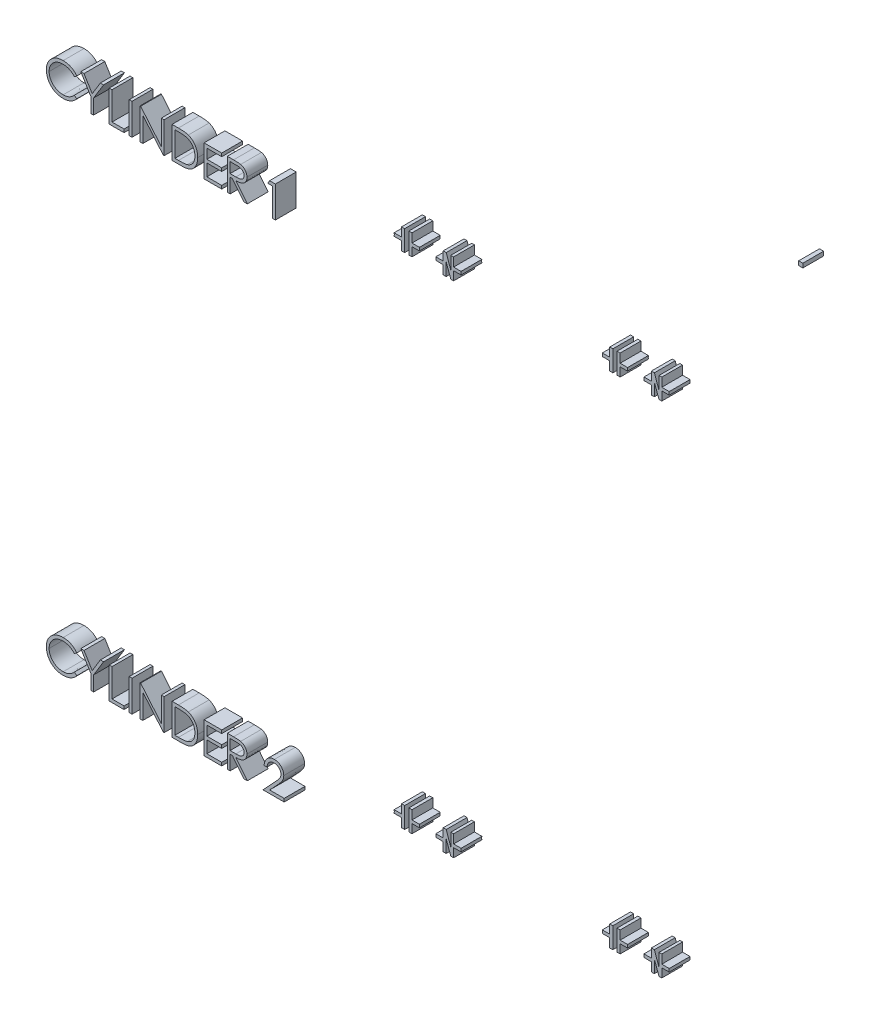
from build123d import *

# Parameters (mm, degrees)
BOSS_EXTRUDE1_DEPTH    = 10
BOSS_EXTRUDE1_2_DEPTH  = 10
BOSS_EXTRUDE1_3_DEPTH  = 10
SKETCH1_W              = 1.346153846
SKETCH1_H              = 15
BOSS_EXTRUDE1_4_DEPTH  = 10
BOSS_EXTRUDE1_5_DEPTH  = 10
BOSS_EXTRUDE1_6_DEPTH  = 10
BOSS_EXTRUDE1_7_DEPTH  = 10
BOSS_EXTRUDE1_8_DEPTH  = 10
BOSS_EXTRUDE1_9_DEPTH  = 10
BOSS_EXTRUDE1_10_DEPTH = 10
BOSS_EXTRUDE1_11_DEPTH = 10
BOSS_EXTRUDE1_12_DEPTH = 10
BOSS_EXTRUDE1_13_DEPTH = 10
BOSS_EXTRUDE1_14_DEPTH = 10
BOSS_EXTRUDE1_15_DEPTH = 10
SKETCH1_W_2            = 2
SKETCH1_H_2            = 2
BOSS_EXTRUDE1_16_DEPTH = 10
BOSS_EXTRUDE1_17_DEPTH = 10
BOSS_EXTRUDE1_18_DEPTH = 10
BOSS_EXTRUDE1_19_DEPTH = 10
BOSS_EXTRUDE1_20_DEPTH = 10
BOSS_EXTRUDE1_21_DEPTH = 10
BOSS_EXTRUDE1_22_DEPTH = 10
BOSS_EXTRUDE1_23_DEPTH = 10
BOSS_EXTRUDE1_24_DEPTH = 10
BOSS_EXTRUDE1_25_DEPTH = 10
BOSS_EXTRUDE1_26_DEPTH = 10
BOSS_EXTRUDE1_27_DEPTH = 10
BOSS_EXTRUDE1_28_DEPTH = 10
BOSS_EXTRUDE1_29_DEPTH = 10
BOSS_EXTRUDE1_30_DEPTH = 10
BOSS_EXTRUDE1_31_DEPTH = 10


with BuildPart() as part:
    # Sketch1 → Boss-Extrude1 (new body)
    with BuildSketch(Plane.XY):
        with BuildLine():
            Line((575.642307692, 223.626418269), (574.464423077, 224.518846154))
            add(Edge.make_bspline(
                [(574.464423077, 224.518846154), (574.282999257, 224.319685088), (573.927408048, 223.929328824), (573.33605846, 223.418093112), (572.712072773, 222.98653078), (572.054924289, 222.630536689), (571.363584632, 222.356688451), (570.64000278, 222.16101166), (569.88413981, 222.040329164), (569.368719629, 222.026083781), (569.106850962, 222.018846154)],
                knots=[0, 0, 0, 0, 0.132188852, 0.259090531, 0.382819359, 0.504060246, 0.625245266, 0.747051364, 0.87148481, 1, 1, 1, 1], degree=3))
            add(Edge.make_bspline(
                [(569.106850962, 222.018846154), (568.869173258, 222.023281916), (568.402161544, 222.031997722), (567.718710136, 222.123035638), (567.06550384, 222.262596168), (566.443963352, 222.460839286), (565.855206365, 222.7187362), (565.294702275, 223.028657125), (564.768639797, 223.400445331), (564.278329157, 223.822647011), (563.831438788, 224.284831073), (563.443082199, 224.783759206), (563.107765292, 225.307640007), (562.842397933, 225.864390113), (562.627188317, 226.444589437), (562.483595069, 227.055392324), (562.389102209, 227.692980655), (562.378484719, 228.128270305), (562.373076923, 228.349975962)],
                knots=[0, 0, 0, 0, 0.068959261, 0.135497702, 0.199770956, 0.262666103, 0.324516234, 0.386081404, 0.448275028, 0.511160094, 0.573673691, 0.634570614, 0.694424357, 0.753853568, 0.813273531, 0.873709896, 0.935676783, 1, 1, 1, 1], degree=3))
            add(Edge.make_bspline(
                [(562.373076923, 228.349975962), (562.37480555, 228.497328914), (562.378234879, 228.789654539), (562.42318547, 229.220941738), (562.488018313, 229.6417594), (562.581980528, 230.051228397), (562.700691568, 230.450447657), (562.85071352, 230.836608099), (563.020127289, 231.214072687), (563.222467574, 231.576377508), (563.448397682, 231.92486354), (563.693478012, 232.258515713), (563.962566486, 232.572934319), (564.254731979, 232.86711415), (564.56785746, 233.14419032), (564.902263037, 233.402915019), (565.258213241, 233.644257956), (565.63440986, 233.865518433), (566.027059452, 234.061410976), (566.426533452, 234.238646004), (566.838358032, 234.381897778), (567.256570711, 234.501780431), (567.683905566, 234.596603245), (568.119818643, 234.660508431), (568.564026386, 234.70597611), (568.863344926, 234.709422578), (569.013701923, 234.711153846)],
                knots=[0, 0, 0, 0, 0.043076442, 0.085457044, 0.126680955, 0.167541081, 0.208224423, 0.248372742, 0.288616056, 0.329131374, 0.36959477, 0.410019977, 0.450116969, 0.4905082, 0.53118205, 0.572314273, 0.614074837, 0.65687851, 0.699847251, 0.74235017, 0.784596933, 0.827247979, 0.869537373, 0.912498125, 0.956045091, 1, 1, 1, 1], degree=3))
            add(Edge.make_bspline(
                [(569.013701923, 234.711153846), (569.286618569, 234.704254849), (569.82317971, 234.690691242), (570.609655846, 234.565457632), (571.363062299, 234.368729498), (571.961553078, 234.13410312), (572.419060512, 233.909261751), (572.749909277, 233.723828588), (573.066455557, 233.516952433), (573.373994641, 233.296594865), (573.665076589, 233.051272524), (573.944940772, 232.789564261), (574.213480212, 232.510223356), (574.380397841, 232.311293717), (574.464423077, 232.211153846)],
                knots=[0, 0, 0, 0, 0.131817351, 0.259156302, 0.383852034, 0.50754401, 0.569026624, 0.630149934, 0.690705144, 0.751705654, 0.81287878, 0.874525059, 0.936836741, 1, 1, 1, 1], degree=3))
            Line((574.464423077, 232.211153846), (575.642307692, 233.112596154))
            add(Edge.make_bspline(
                [(575.642307692, 233.112596154), (575.550441916, 233.233796056), (575.367213937, 233.475531487), (575.070380745, 233.818962162), (574.749117265, 234.136951859), (574.414333504, 234.438659971), (574.056524153, 234.715787865), (573.681674759, 234.97419846), (573.287147679, 235.21169399), (572.87607675, 235.427980024), (572.448590001, 235.620659164), (572.006738486, 235.787958584), (571.553308882, 235.934274148), (571.085640527, 236.04659124), (570.607307747, 236.137088682), (570.115983488, 236.203575566), (569.611329264, 236.243459032), (569.270184275, 236.247549078), (569.097836538, 236.249615385)],
                knots=[0, 0, 0, 0, 0.060488392, 0.120645209, 0.180371681, 0.240193757, 0.299808496, 0.360260137, 0.421209965, 0.48287315, 0.544930238, 0.607604572, 0.670733165, 0.734317765, 0.79878501, 0.864317054, 0.931452463, 1, 1, 1, 1], degree=3))
            add(Edge.make_bspline(
                [(569.097836538, 236.249615385), (568.815049223, 236.242701079), (568.25849597, 236.229093045), (567.442757764, 236.121448261), (566.662400468, 235.948506032), (565.918890404, 235.701458333), (565.213813897, 235.380046208), (564.541891267, 234.995542568), (563.910524921, 234.533515981), (563.320950627, 234.008347327), (562.783318194, 233.433998393), (562.313316156, 232.818926394), (561.914630668, 232.172464088), (561.591893449, 231.490477172), (561.337335355, 230.77817541), (561.158111942, 230.031812272), (561.04670139, 229.252781044), (561.033588192, 228.72194851), (561.026923077, 228.452139423)],
                knots=[0, 0, 0, 0, 0.067671688, 0.133184538, 0.196584735, 0.258754454, 0.320344524, 0.381783214, 0.443742231, 0.507256563, 0.570530156, 0.631765485, 0.692252318, 0.751986087, 0.81204519, 0.872986468, 0.935442154, 1, 1, 1, 1], degree=3))
            add(Edge.make_bspline(
                [(561.026923077, 228.452139423), (561.032391626, 228.195437377), (561.043150007, 227.690422568), (561.137228311, 226.947931387), (561.282004862, 226.233436326), (561.490988004, 225.547604666), (561.758313379, 224.890090686), (562.088945758, 224.26236979), (562.475198688, 223.661144156), (562.777099303, 223.290186826), (562.928966346, 223.103581731)],
                knots=[0, 0, 0, 0, 0.132689425, 0.261042424, 0.386386228, 0.509266138, 0.631220251, 0.752843984, 0.87567149, 1, 1, 1, 1], degree=3))
            add(Edge.make_bspline(
                [(562.928966346, 223.103581731), (563.023782267, 222.996155699), (563.212365203, 222.782492042), (563.517175815, 222.486186281), (563.832833781, 222.209043562), (564.16110914, 221.951997982), (564.504846658, 221.718619366), (564.858968511, 221.501411375), (565.226956274, 221.305161837), (565.608640702, 221.131521055), (566.002790733, 220.97764254), (566.409741635, 220.84671754), (566.827858425, 220.729840726), (567.261255461, 220.642650697), (567.706003858, 220.568764421), (568.164530633, 220.51969412), (568.635525283, 220.483727688), (568.954535383, 220.481507441), (569.115865385, 220.480384615)],
                knots=[0, 0, 0, 0, 0.061868212, 0.123052003, 0.183446095, 0.243243806, 0.303000816, 0.362801656, 0.422604062, 0.483004351, 0.543819968, 0.60524646, 0.667586294, 0.731220138, 0.796083256, 0.862250438, 0.930337199, 1, 1, 1, 1], degree=3))
            add(Edge.make_bspline(
                [(569.115865385, 220.480384615), (569.28622619, 220.482313011), (569.622403709, 220.486118364), (570.120703175, 220.527869426), (570.606576635, 220.58881089), (571.081072736, 220.679972678), (571.5424792, 220.796766692), (571.991753095, 220.938730504), (572.428914959, 221.103532366), (572.852080443, 221.296034854), (573.260742495, 221.513007387), (573.65446692, 221.74996832), (574.031919687, 222.00840474), (574.388138794, 222.291923878), (574.729520409, 222.592470826), (575.052137397, 222.91605955), (575.358386042, 223.260081163), (575.547515793, 223.504110618), (575.642307692, 223.626418269)],
                knots=[0, 0, 0, 0, 0.067899252, 0.133987404, 0.199214717, 0.263038543, 0.32647147, 0.388856411, 0.450779616, 0.51260877, 0.574053796, 0.635137079, 0.695721083, 0.756273499, 0.816524999, 0.876946938, 0.938325761, 1, 1, 1, 1], degree=3))
        make_face()
    extrude(amount=BOSS_EXTRUDE1_DEPTH)


with BuildPart() as body_2:
    # Sketch1 → Boss-Extrude1 2 (new body)
    with BuildSketch(Plane.XY):
        Polygon((577.565384615, 235.865), (582.373076923, 227.995408654), (582.373076923, 220.865), (583.719230769, 220.865), (583.719230769, 227.995408654), (588.526923077, 235.865), (586.982451923, 235.865), (583.043149038, 229.425697115), (579.106850962, 235.865), align=None)
    extrude(amount=BOSS_EXTRUDE1_2_DEPTH)


with BuildPart() as body_3:
    # Sketch1 → Boss-Extrude1 3 (new body)
    with BuildSketch(Plane.XY):
        Polygon((591.219230769, 235.865), (591.219230769, 220.865), (598.334615385, 220.865), (598.334615385, 222.403461538), (592.565384615, 222.403461538), (592.565384615, 235.865), align=None)
    extrude(amount=BOSS_EXTRUDE1_3_DEPTH)


with BuildPart() as body_4:
    # Sketch1 → Boss-Extrude1 4 (new body)
    with BuildSketch(Plane.XY):
        with Locations((601.507692308, 228.365)):
            Rectangle(SKETCH1_W, SKETCH1_H)
    extrude(amount=BOSS_EXTRUDE1_4_DEPTH)


with BuildPart() as body_5:
    # Sketch1 → Boss-Extrude1 5 (new body)
    with BuildSketch(Plane.XY):
        Polygon((606.026923077, 220.865), (607.373076923, 220.865), (607.373076923, 232.643846154), (617.258894231, 220.865), (617.565384615, 220.865), (617.565384615, 235.865), (616.219230769, 235.865), (616.219230769, 224.059110577), (606.309375, 235.865), (606.026923077, 235.865), align=None)
    extrude(amount=BOSS_EXTRUDE1_5_DEPTH)


with BuildPart() as body_6:
    # Sketch1 → Boss-Extrude1 6 (new body)
    with BuildSketch(Plane.XY):
        with BuildLine():
            Line((621.411538462, 220.865), (626.059975962, 220.865))
            add(Edge.make_bspline(
                [(626.059975962, 220.865), (626.281400658, 220.866844984), (626.711597509, 220.870429527), (627.338097322, 220.911370667), (627.927121461, 220.971912349), (628.477764937, 221.062243646), (628.99056761, 221.176118914), (629.466415515, 221.312604408), (629.904140656, 221.47730445), (630.305609781, 221.671963117), (630.678427164, 221.895107866), (631.033468811, 222.14006453), (631.369144513, 222.416458881), (631.686320441, 222.718882789), (631.987073153, 223.049862555), (632.267516133, 223.40889922), (632.530323604, 223.797080054), (632.775215254, 224.208865936), (632.998286162, 224.643512261), (633.189581146, 225.099271444), (633.356570366, 225.569981063), (633.486866852, 226.059959139), (633.594199128, 226.563983568), (633.663526214, 227.086470302), (633.711223282, 227.624931284), (633.716535194, 227.990291808), (633.719230769, 228.175697115)],
                knots=[0, 0, 0, 0, 0.055036654, 0.10692843, 0.156010544, 0.202184639, 0.245558196, 0.286532629, 0.325146751, 0.361673394, 0.397287349, 0.433066302, 0.468805377, 0.505261512, 0.541925381, 0.579880409, 0.618416581, 0.658386106, 0.698920133, 0.739755884, 0.781177266, 0.822975614, 0.865704729, 0.9091932, 0.953919317, 1, 1, 1, 1], degree=3))
            add(Edge.make_bspline(
                [(633.719230769, 228.175697115), (633.716177597, 228.389181865), (633.710160234, 228.809929567), (633.650284563, 229.429983235), (633.559504856, 230.028756947), (633.426448609, 230.603884281), (633.257620496, 231.156034915), (633.054246238, 231.686422949), (632.809364133, 232.193573415), (632.527639878, 232.674910782), (632.215175753, 233.129517873), (631.873969793, 233.552039331), (631.496793093, 233.933712555), (631.099075266, 234.288416906), (630.665278931, 234.601084889), (630.205313089, 234.880569611), (629.716711135, 235.127239474), (629.373548883, 235.25800302), (629.2, 235.324134615)],
                knots=[0, 0, 0, 0, 0.070764039, 0.139465732, 0.206349458, 0.271440691, 0.334995672, 0.397655006, 0.459592949, 0.521505959, 0.582395157, 0.642352576, 0.701298058, 0.760124611, 0.818845145, 0.878305704, 0.938455034, 1, 1, 1, 1], degree=3))
            add(Edge.make_bspline(
                [(629.2, 235.324134615), (629.067315584, 235.368002623), (628.786732268, 235.460768838), (628.330508798, 235.569575283), (627.819829049, 235.661719873), (627.252052426, 235.735232874), (626.628768744, 235.795102272), (625.948266905, 235.836204268), (625.212784988, 235.859438802), (624.703823136, 235.863103271), (624.440384615, 235.865)],
                knots=[0, 0, 0, 0, 0.087120097, 0.184229969, 0.292168681, 0.410633458, 0.541156388, 0.682594089, 0.835710784, 1, 1, 1, 1], degree=3))
            Line((624.440384615, 235.865), (621.411538462, 235.865))
            Line((621.411538462, 235.865), (621.411538462, 220.865))
        make_face()
        with BuildLine():
            Line((622.757692308, 222.403461538), (624.479447115, 222.403461538))
            add(Edge.make_bspline(
                [(624.479447115, 222.403461538), (624.726854419, 222.404524809), (625.202709269, 222.406569867), (625.886957829, 222.424515023), (626.512155242, 222.453837612), (627.078390282, 222.49487366), (627.585343244, 222.549167725), (628.0340736, 222.609703022), (628.423110422, 222.685120669), (628.658522294, 222.753481923), (628.767307692, 222.785072115)],
                knots=[0, 0, 0, 0, 0.171900665, 0.330627932, 0.475548836, 0.60674619, 0.725023803, 0.829742387, 0.92132282, 1, 1, 1, 1], degree=3))
            add(Edge.make_bspline(
                [(628.767307692, 222.785072115), (628.904229244, 222.833293079), (629.174801979, 222.92858325), (629.564292344, 223.102401798), (629.92753665, 223.308296383), (630.27086533, 223.537163271), (630.589408139, 223.797074709), (630.886940066, 224.082378946), (631.162862072, 224.394527982), (631.414323392, 224.733134389), (631.63935898, 225.096090656), (631.834235678, 225.479828515), (632.005027956, 225.880143416), (632.139079067, 226.303182667), (632.244145857, 226.745164346), (632.318565948, 227.206119546), (632.364914767, 227.685962182), (632.370320972, 228.012328429), (632.373076923, 228.178701923)],
                knots=[0, 0, 0, 0, 0.0624145, 0.123338231, 0.183124538, 0.241782995, 0.300578883, 0.359680075, 0.418881641, 0.479530664, 0.540850536, 0.602303396, 0.664463212, 0.727805723, 0.792894815, 0.859672328, 0.928464401, 1, 1, 1, 1], degree=3))
            add(Edge.make_bspline(
                [(632.373076923, 228.178701923), (632.37087712, 228.354131124), (632.366555588, 228.698763343), (632.312237114, 229.204437751), (632.232859019, 229.690783396), (632.118071794, 230.157832805), (631.971796598, 230.606497172), (631.789248134, 231.034295073), (631.580676908, 231.445744511), (631.33251975, 231.831348935), (631.060738636, 232.196033689), (630.759119153, 232.530126184), (630.432453274, 232.834387471), (630.084303919, 233.113555954), (629.704859208, 233.356400279), (629.303057676, 233.573628912), (628.873004799, 233.757982732), (628.573807532, 233.856035001), (628.421754808, 233.905865385)],
                knots=[0, 0, 0, 0, 0.070151176, 0.137812606, 0.203226247, 0.267174055, 0.330024003, 0.391794272, 0.453084399, 0.514333908, 0.574999993, 0.634865483, 0.694116315, 0.753441622, 0.8131258, 0.874079686, 0.936007013, 1, 1, 1, 1], degree=3))
            add(Edge.make_bspline(
                [(628.421754808, 233.905865385), (628.29596418, 233.940650075), (628.028498793, 234.014611872), (627.592043948, 234.09529204), (627.100836164, 234.166454179), (626.552694588, 234.226702919), (625.948244049, 234.269934296), (625.287019672, 234.302382787), (624.568735653, 234.324268355), (624.070810507, 234.325762814), (623.812379808, 234.326538462)],
                knots=[0, 0, 0, 0, 0.084318617, 0.179284514, 0.286582528, 0.405111483, 0.535592873, 0.67819021, 0.83297584, 1, 1, 1, 1], degree=3))
            Line((623.812379808, 234.326538462), (622.757692308, 234.326538462))
            Line((622.757692308, 234.326538462), (622.757692308, 222.403461538))
        make_face(mode=Mode.SUBTRACT)
    extrude(amount=BOSS_EXTRUDE1_6_DEPTH)


with BuildPart() as body_7:
    # Sketch1 → Boss-Extrude1 7 (new body)
    with BuildSketch(Plane.XY):
        Polygon((636.796153846, 235.865), (636.796153846, 220.865), (645.257692308, 220.865), (645.257692308, 222.403461538), (638.142307692, 222.403461538), (638.142307692, 228.172692308), (645.257692308, 228.172692308), (645.257692308, 229.711153846), (638.142307692, 229.711153846), (638.142307692, 234.326538462), (645.257692308, 234.326538462), (645.257692308, 235.865), align=None)
    extrude(amount=BOSS_EXTRUDE1_7_DEPTH)


with BuildPart() as body_8:
    # Sketch1 → Boss-Extrude1 8 (new body)
    with BuildSketch(Plane.XY):
        with BuildLine():
            Line((647.95, 235.865), (647.95, 220.865))
            Line((647.95, 220.865), (649.296153846, 220.865))
            Line((649.296153846, 220.865), (649.296153846, 227.788076923))
            Line((649.296153846, 227.788076923), (650.389903846, 227.788076923))
            Line((650.389903846, 227.788076923), (655.900721154, 220.865))
            Line((655.900721154, 220.865), (657.565384615, 220.865))
            Line((657.565384615, 220.865), (652.054567308, 227.788076923))
            add(Edge.make_bspline(
                [(652.054567308, 227.788076923), (652.211850176, 227.78993331), (652.517589045, 227.793541903), (652.96264398, 227.81777354), (653.381658435, 227.856544659), (653.774931244, 227.909480492), (654.141519821, 227.979595343), (654.482949724, 228.057860908), (654.795949636, 228.159159589), (655.176153349, 228.303129198), (655.606564703, 228.527926932), (656.068914467, 228.852097986), (656.464592143, 229.239485652), (656.793818467, 229.680531274), (657.052346849, 230.169799723), (657.239960505, 230.697753928), (657.354496664, 231.263729134), (657.366781217, 231.653716997), (657.373076923, 231.853581731)],
                knots=[0, 0, 0, 0, 0.062051881, 0.120621349, 0.175788677, 0.228041389, 0.277100494, 0.323010858, 0.366127082, 0.406782783, 0.483310827, 0.556993586, 0.628810003, 0.700808834, 0.77328647, 0.846279356, 0.921219764, 1, 1, 1, 1], degree=3))
            add(Edge.make_bspline(
                [(657.373076923, 231.853581731), (657.371030189, 231.973879269), (657.366993665, 232.21112745), (657.327345718, 232.5589602), (657.261233264, 232.892769329), (657.167470521, 233.211034066), (657.051025448, 233.516637285), (656.904769106, 233.80661526), (656.735103564, 234.083917075), (656.533936199, 234.340359259), (656.320586356, 234.584794294), (656.084162941, 234.803825176), (655.834227324, 235.002974272), (655.569645361, 235.181151899), (655.287688971, 235.335282129), (654.98977044, 235.466509092), (654.6771273, 235.579907381), (654.459983059, 235.633558368), (654.350240385, 235.660673077)],
                knots=[0, 0, 0, 0, 0.068358676, 0.134815488, 0.19868309, 0.261560952, 0.323202297, 0.384310216, 0.445927894, 0.507648068, 0.569349858, 0.630173324, 0.690547467, 0.750867897, 0.811255462, 0.872936234, 0.935783157, 1, 1, 1, 1], degree=3))
            add(Edge.make_bspline(
                [(654.350240385, 235.660673077), (654.268264202, 235.67756556), (654.087210554, 235.714874516), (653.788120422, 235.755047348), (653.438032033, 235.785735835), (653.038557797, 235.817844155), (652.588472772, 235.83545237), (652.087785213, 235.855913895), (651.536756911, 235.863052879), (651.152122007, 235.864333203), (650.951802885, 235.865)],
                knots=[0, 0, 0, 0, 0.073627579, 0.162614816, 0.265301639, 0.382842422, 0.515177949, 0.661565586, 0.823742245, 1, 1, 1, 1], degree=3))
            Line((650.951802885, 235.865), (647.95, 235.865))
        make_face()
        with BuildLine():
            Line((649.296153846, 229.326538462), (652.042548077, 229.305504808))
            add(Edge.make_bspline(
                [(652.042548077, 229.305504808), (652.170776815, 229.305448079), (652.419320631, 229.305338123), (652.778894909, 229.322454307), (653.113695388, 229.341925671), (653.422441469, 229.37170858), (653.705271077, 229.410091745), (653.962042848, 229.458104535), (654.193175928, 229.514041946), (654.462741092, 229.600620342), (654.763754798, 229.737788992), (655.090889626, 229.937355415), (655.369471074, 230.188365926), (655.604833341, 230.475395023), (655.793959476, 230.790978946), (655.927296851, 231.131334815), (656.011907318, 231.487870235), (656.021886799, 231.732919268), (656.026923077, 231.856586538)],
                knots=[0, 0, 0, 0, 0.07166815, 0.138913286, 0.20118457, 0.259124428, 0.312255041, 0.36068151, 0.405086143, 0.445101659, 0.51877778, 0.589461579, 0.658462242, 0.727283218, 0.796322487, 0.863174893, 0.930949381, 1, 1, 1, 1], degree=3))
            add(Edge.make_bspline(
                [(656.026923077, 231.856586538), (656.021771129, 231.977214712), (656.011561849, 232.216255734), (655.928209984, 232.566209636), (655.787255493, 232.896496565), (655.597303044, 233.205772929), (655.365878095, 233.486511797), (655.09451604, 233.726713882), (654.790636632, 233.924925873), (654.506617211, 234.051587504), (654.2527563, 234.129244018), (654.032343471, 234.183891863), (653.783294281, 234.227796729), (653.504399459, 234.262974133), (653.196849612, 234.293209609), (652.859089679, 234.313574374), (652.493360621, 234.325633792), (652.239873773, 234.326229887), (652.108653846, 234.326538462)],
                knots=[0, 0, 0, 0, 0.068814296, 0.136364825, 0.204019354, 0.273063739, 0.34291332, 0.410965444, 0.479168767, 0.549308007, 0.587651576, 0.630646669, 0.678878786, 0.731934299, 0.791111423, 0.85528319, 0.925085939, 1, 1, 1, 1], degree=3))
            Line((652.108653846, 234.326538462), (649.296153846, 234.326538462))
            Line((649.296153846, 234.326538462), (649.296153846, 229.326538462))
        make_face(mode=Mode.SUBTRACT)
    extrude(amount=BOSS_EXTRUDE1_8_DEPTH)


with BuildPart() as body_9:
    # Sketch1 → Boss-Extrude1 9 (new body)
    with BuildSketch(Plane.XY):
        with BuildLine():
            Line((670.882692308, 227.072932692), (665.065384615, 220.865))
            Line((665.065384615, 220.865), (675.257692308, 220.865))
            Line((675.257692308, 220.865), (675.257692308, 222.403461538))
            Line((675.257692308, 222.403461538), (668.280528846, 222.403461538))
            Line((668.280528846, 222.403461538), (672.033533654, 226.405865385))
            add(Edge.make_bspline(
                [(672.033533654, 226.405865385), (672.177123296, 226.559776253), (672.45422979, 226.856801165), (672.849054178, 227.291673902), (673.204831325, 227.7052229), (673.524279066, 228.093055914), (673.809696552, 228.455332095), (674.056778063, 228.793159594), (674.263262902, 229.109940914), (674.497351049, 229.491270455), (674.729092603, 229.966894965), (674.920158733, 230.557916648), (675.04382603, 231.167363894), (675.058156137, 231.581553015), (675.065384615, 231.790480769)],
                knots=[0, 0, 0, 0, 0.099511707, 0.192042683, 0.277660163, 0.357386889, 0.429566701, 0.495677803, 0.555171521, 0.608281408, 0.707182885, 0.804364563, 0.901316403, 1, 1, 1, 1], degree=3))
            add(Edge.make_bspline(
                [(675.065384615, 231.790480769), (675.060927871, 231.938877188), (675.05216177, 232.230762426), (674.995044283, 232.662011616), (674.89399482, 233.076642485), (674.760897082, 233.478946893), (674.580092739, 233.863067757), (674.363179182, 234.232621838), (674.109883802, 234.59042714), (673.816277748, 234.925580216), (673.49653439, 235.239525131), (673.141330915, 235.506181551), (672.766660724, 235.736742431), (672.368063305, 235.928675691), (671.942544305, 236.071456047), (671.493498758, 236.173222868), (671.02180441, 236.238198708), (670.698612076, 236.245764857), (670.534134615, 236.249615385)],
                knots=[0, 0, 0, 0, 0.062710358, 0.123346829, 0.183401472, 0.242827912, 0.302097394, 0.3624199, 0.423724785, 0.48703218, 0.550490781, 0.612709308, 0.674264977, 0.736170327, 0.799211176, 0.863483202, 0.93052454, 1, 1, 1, 1], degree=3))
            add(Edge.make_bspline(
                [(670.534134615, 236.249615385), (670.366651129, 236.245919185), (670.037336749, 236.238651532), (669.553997593, 236.171038622), (669.091642488, 236.058660166), (668.648240072, 235.907203684), (668.227814077, 235.705426933), (667.825621103, 235.464065485), (667.442881362, 235.178400158), (667.088158623, 234.847596283), (666.761558335, 234.487001241), (666.473584689, 234.097039003), (666.230456001, 233.68132465), (666.02771481, 233.241444048), (665.864465722, 232.779144417), (665.749004819, 232.290338136), (665.668312151, 231.778949966), (665.651081205, 231.428204904), (665.642307692, 231.249615385)],
                knots=[0, 0, 0, 0, 0.064450057, 0.126724915, 0.187420734, 0.247416837, 0.306748837, 0.366594824, 0.427749431, 0.490235223, 0.553030761, 0.614804622, 0.676505031, 0.7380957, 0.801021326, 0.864896711, 0.931209206, 1, 1, 1, 1], degree=3))
            Line((665.642307692, 231.249615385), (666.988461538, 231.249615385))
            add(Edge.make_bspline(
                [(666.988461538, 231.249615385), (667.001221059, 231.383141386), (667.026114719, 231.643648893), (667.100629776, 232.020883385), (667.194800421, 232.376459262), (667.318039092, 232.708832605), (667.46979295, 233.016823536), (667.643724439, 233.303226745), (667.842782479, 233.567269444), (668.069342389, 233.804130592), (668.315241775, 234.016875833), (668.576939872, 234.204519375), (668.854928632, 234.36176971), (669.148584, 234.488020633), (669.456477869, 234.587349238), (669.779131202, 234.659974268), (670.117355629, 234.702071399), (670.34772047, 234.708089422), (670.465024038, 234.711153846)],
                knots=[0, 0, 0, 0, 0.073647972, 0.143686243, 0.210961606, 0.275557494, 0.33806421, 0.399310902, 0.459399725, 0.519339717, 0.579024067, 0.637808782, 0.695959115, 0.754122464, 0.813112847, 0.873453089, 0.935561328, 1, 1, 1, 1], degree=3))
            add(Edge.make_bspline(
                [(670.465024038, 234.711153846), (670.577342319, 234.708174826), (670.797771586, 234.702328375), (671.120588799, 234.659117729), (671.430809135, 234.590295246), (671.727575433, 234.490972184), (672.011461671, 234.364357196), (672.281676403, 234.209903864), (672.53708033, 234.025086355), (672.778843986, 233.816452617), (672.998920855, 233.588652768), (673.189163984, 233.34570006), (673.354049898, 233.094396573), (673.489507355, 232.831058065), (673.59212989, 232.555363983), (673.663746344, 232.270086209), (673.711136477, 231.974347242), (673.716506159, 231.772637312), (673.719230769, 231.670288462)],
                knots=[0, 0, 0, 0, 0.068026526, 0.133504868, 0.196949897, 0.260270038, 0.322741383, 0.384982457, 0.448465195, 0.513424174, 0.578224258, 0.640011153, 0.700094169, 0.760066784, 0.819011503, 0.877878094, 0.938034599, 1, 1, 1, 1], degree=3))
            add(Edge.make_bspline(
                [(673.719230769, 231.670288462), (673.712968667, 231.507524868), (673.700519372, 231.183944709), (673.59674145, 230.705113626), (673.426545639, 230.239969243), (673.228485718, 229.859345027), (673.023991165, 229.547599539), (672.835567204, 229.278651895), (672.600400496, 228.986388879), (672.335399758, 228.657967874), (672.026753789, 228.304025524), (671.681158125, 227.919384635), (671.296375653, 227.504771949), (671.024326108, 227.220782578), (670.882692308, 227.072932692)],
                knots=[0, 0, 0, 0, 0.088014415, 0.174975974, 0.263799547, 0.355442995, 0.406413059, 0.465518961, 0.533075531, 0.609352679, 0.69389869, 0.787170798, 0.889197356, 1, 1, 1, 1], degree=3))
        make_face()
    extrude(amount=BOSS_EXTRUDE1_9_DEPTH)


with BuildPart() as body_10:
    # Sketch1 → Boss-Extrude1 10 (new body)
    with BuildSketch(Plane.XY):
        with BuildLine():
            Line((731.65, 242.615), (731.65, 238.365))
            Line((731.65, 238.365), (733.15, 238.365))
            Line((733.15, 238.365), (733.15, 248.365))
            Line((733.15, 248.365), (731.65, 248.365))
            Line((731.65, 248.365), (731.65, 244.115))
            Line((731.65, 244.115), (728.079058411, 244.115))
            ThreePointArc((728.079058411, 244.115), (728.15, 243.365), (728.079058411, 242.615))
            Line((728.079058411, 242.615), (731.65, 242.615))
        make_face()
    extrude(amount=BOSS_EXTRUDE1_10_DEPTH)


with BuildPart() as body_11:
    # Sketch1 → Boss-Extrude1 11 (new body)
    with BuildSketch(Plane.XY):
        with BuildLine():
            Line((735.15, 238.365), (736.65, 238.365))
            Line((736.65, 238.365), (736.65, 242.615))
            Line((736.65, 242.615), (740.220941589, 242.615))
            ThreePointArc((740.220941589, 242.615), (740.15, 243.365), (740.220941589, 244.115))
            Line((740.220941589, 244.115), (736.65, 244.115))
            Line((736.65, 244.115), (736.65, 248.365))
            Line((736.65, 248.365), (735.15, 248.365))
            Line((735.15, 248.365), (735.15, 238.365))
        make_face()
    extrude(amount=BOSS_EXTRUDE1_11_DEPTH)


with BuildPart() as body_12:
    # Sketch1 → Boss-Extrude1 12 (new body)
    with BuildSketch(Plane.XY):
        with BuildLine():
            Line((748.079058411, 242.615), (751.65, 242.615))
            Line((751.65, 242.615), (751.65, 238.365))
            Line((751.65, 238.365), (753.090833047, 238.365))
            Line((753.090833047, 238.365), (753.090833047, 244.444173688))
            Line((753.090833047, 244.444173688), (755.324819877, 238.365))
            Line((755.324819877, 238.365), (756.65, 238.365))
            Line((756.65, 238.365), (756.65, 242.615))
            Line((756.65, 242.615), (760.220941589, 242.615))
            ThreePointArc((760.220941589, 242.615), (760.15, 243.365), (760.220941589, 244.115))
            Line((760.220941589, 244.115), (756.65, 244.115))
            Line((756.65, 244.115), (756.65, 248.365))
            Line((756.65, 248.365), (755.324819877, 248.365))
            Line((755.324819877, 248.365), (755.324819877, 242.088287331))
            Line((755.324819877, 242.088287331), (753.090833047, 248.365))
            Line((753.090833047, 248.365), (751.65, 248.365))
            Line((751.65, 248.365), (751.65, 244.115))
            Line((751.65, 244.115), (748.079058411, 244.115))
            ThreePointArc((748.079058411, 244.115), (748.15, 243.365), (748.079058411, 242.615))
        make_face()
    extrude(amount=BOSS_EXTRUDE1_12_DEPTH)


with BuildPart() as body_13:
    # Sketch1 → Boss-Extrude1 13 (new body)
    with BuildSketch(Plane.XY):
        with BuildLine():
            Line((831.65, 242.615), (831.65, 238.365))
            Line((831.65, 238.365), (833.15, 238.365))
            Line((833.15, 238.365), (833.15, 248.365))
            Line((833.15, 248.365), (831.65, 248.365))
            Line((831.65, 248.365), (831.65, 244.115))
            Line((831.65, 244.115), (828.079058411, 244.115))
            ThreePointArc((828.079058411, 244.115), (828.15, 243.365), (828.079058411, 242.615))
            Line((828.079058411, 242.615), (831.65, 242.615))
        make_face()
    extrude(amount=BOSS_EXTRUDE1_13_DEPTH)


with BuildPart() as body_14:
    # Sketch1 → Boss-Extrude1 14 (new body)
    with BuildSketch(Plane.XY):
        with BuildLine():
            Line((835.15, 238.365), (836.65, 238.365))
            Line((836.65, 238.365), (836.65, 242.615))
            Line((836.65, 242.615), (840.220941589, 242.615))
            ThreePointArc((840.220941589, 242.615), (840.15, 243.365), (840.220941589, 244.115))
            Line((840.220941589, 244.115), (836.65, 244.115))
            Line((836.65, 244.115), (836.65, 248.365))
            Line((836.65, 248.365), (835.15, 248.365))
            Line((835.15, 248.365), (835.15, 238.365))
        make_face()
    extrude(amount=BOSS_EXTRUDE1_14_DEPTH)


with BuildPart() as body_15:
    # Sketch1 → Boss-Extrude1 15 (new body)
    with BuildSketch(Plane.XY):
        with BuildLine():
            Line((848.079058411, 242.615), (851.65, 242.615))
            Line((851.65, 242.615), (851.65, 238.365))
            Line((851.65, 238.365), (853.090833047, 238.365))
            Line((853.090833047, 238.365), (853.090833047, 244.444173688))
            Line((853.090833047, 244.444173688), (855.324819877, 238.365))
            Line((855.324819877, 238.365), (856.65, 238.365))
            Line((856.65, 238.365), (856.65, 242.615))
            Line((856.65, 242.615), (860.220941589, 242.615))
            ThreePointArc((860.220941589, 242.615), (860.15, 243.365), (860.220941589, 244.115))
            Line((860.220941589, 244.115), (856.65, 244.115))
            Line((856.65, 244.115), (856.65, 248.365))
            Line((856.65, 248.365), (855.324819877, 248.365))
            Line((855.324819877, 248.365), (855.324819877, 242.088287331))
            Line((855.324819877, 242.088287331), (853.090833047, 248.365))
            Line((853.090833047, 248.365), (851.65, 248.365))
            Line((851.65, 248.365), (851.65, 244.115))
            Line((851.65, 244.115), (848.079058411, 244.115))
            ThreePointArc((848.079058411, 244.115), (848.15, 243.365), (848.079058411, 242.615))
        make_face()
    extrude(amount=BOSS_EXTRUDE1_15_DEPTH)


with BuildPart() as body_16:
    # Sketch1 → Boss-Extrude1 16 (new body)
    with BuildSketch(Plane.XY):
        with Locations((923.4, 568.6)):
            Rectangle(SKETCH1_W_2, SKETCH1_H_2)
    extrude(amount=BOSS_EXTRUDE1_16_DEPTH)


with BuildPart() as body_17:
    # Sketch1 → Boss-Extrude1 17 (new body)
    with BuildSketch(Plane.XY):
        with BuildLine():
            Line((848.079058411, 482.615), (851.65, 482.615))
            Line((851.65, 482.615), (851.65, 478.365))
            Line((851.65, 478.365), (853.090833047, 478.365))
            Line((853.090833047, 478.365), (853.090833047, 484.444173688))
            Line((853.090833047, 484.444173688), (855.324819877, 478.365))
            Line((855.324819877, 478.365), (856.65, 478.365))
            Line((856.65, 478.365), (856.65, 482.615))
            Line((856.65, 482.615), (860.220941589, 482.615))
            ThreePointArc((860.220941589, 482.615), (860.15, 483.365), (860.220941589, 484.115))
            Line((860.220941589, 484.115), (856.65, 484.115))
            Line((856.65, 484.115), (856.65, 488.365))
            Line((856.65, 488.365), (855.324819877, 488.365))
            Line((855.324819877, 488.365), (855.324819877, 482.088287331))
            Line((855.324819877, 482.088287331), (853.090833047, 488.365))
            Line((853.090833047, 488.365), (851.65, 488.365))
            Line((851.65, 488.365), (851.65, 484.115))
            Line((851.65, 484.115), (848.079058411, 484.115))
            ThreePointArc((848.079058411, 484.115), (848.15, 483.365), (848.079058411, 482.615))
        make_face()
    extrude(amount=BOSS_EXTRUDE1_17_DEPTH)


with BuildPart() as body_18:
    # Sketch1 → Boss-Extrude1 18 (new body)
    with BuildSketch(Plane.XY):
        with BuildLine():
            Line((835.15, 478.365), (836.65, 478.365))
            Line((836.65, 478.365), (836.65, 482.615))
            Line((836.65, 482.615), (840.220941589, 482.615))
            ThreePointArc((840.220941589, 482.615), (840.15, 483.365), (840.220941589, 484.115))
            Line((840.220941589, 484.115), (836.65, 484.115))
            Line((836.65, 484.115), (836.65, 488.365))
            Line((836.65, 488.365), (835.15, 488.365))
            Line((835.15, 488.365), (835.15, 478.365))
        make_face()
    extrude(amount=BOSS_EXTRUDE1_18_DEPTH)


with BuildPart() as body_19:
    # Sketch1 → Boss-Extrude1 19 (new body)
    with BuildSketch(Plane.XY):
        with BuildLine():
            Line((831.65, 482.615), (831.65, 478.365))
            Line((831.65, 478.365), (833.15, 478.365))
            Line((833.15, 478.365), (833.15, 488.365))
            Line((833.15, 488.365), (831.65, 488.365))
            Line((831.65, 488.365), (831.65, 484.115))
            Line((831.65, 484.115), (828.079058411, 484.115))
            ThreePointArc((828.079058411, 484.115), (828.15, 483.365), (828.079058411, 482.615))
            Line((828.079058411, 482.615), (831.65, 482.615))
        make_face()
    extrude(amount=BOSS_EXTRUDE1_19_DEPTH)


with BuildPart() as body_20:
    # Sketch1 → Boss-Extrude1 20 (new body)
    with BuildSketch(Plane.XY):
        with BuildLine():
            Line((731.65, 482.615), (731.65, 478.365))
            Line((731.65, 478.365), (733.15, 478.365))
            Line((733.15, 478.365), (733.15, 488.365))
            Line((733.15, 488.365), (731.65, 488.365))
            Line((731.65, 488.365), (731.65, 484.115))
            Line((731.65, 484.115), (728.079058411, 484.115))
            ThreePointArc((728.079058411, 484.115), (728.15, 483.365), (728.079058411, 482.615))
            Line((728.079058411, 482.615), (731.65, 482.615))
        make_face()
    extrude(amount=BOSS_EXTRUDE1_20_DEPTH)


with BuildPart() as body_21:
    # Sketch1 → Boss-Extrude1 21 (new body)
    with BuildSketch(Plane.XY):
        with BuildLine():
            Line((735.15, 478.365), (736.65, 478.365))
            Line((736.65, 478.365), (736.65, 482.615))
            Line((736.65, 482.615), (740.220941589, 482.615))
            ThreePointArc((740.220941589, 482.615), (740.15, 483.365), (740.220941589, 484.115))
            Line((740.220941589, 484.115), (736.65, 484.115))
            Line((736.65, 484.115), (736.65, 488.365))
            Line((736.65, 488.365), (735.15, 488.365))
            Line((735.15, 488.365), (735.15, 478.365))
        make_face()
    extrude(amount=BOSS_EXTRUDE1_21_DEPTH)


with BuildPart() as body_22:
    # Sketch1 → Boss-Extrude1 22 (new body)
    with BuildSketch(Plane.XY):
        with BuildLine():
            Line((748.079058411, 482.615), (751.65, 482.615))
            Line((751.65, 482.615), (751.65, 478.365))
            Line((751.65, 478.365), (753.090833047, 478.365))
            Line((753.090833047, 478.365), (753.090833047, 484.444173688))
            Line((753.090833047, 484.444173688), (755.324819877, 478.365))
            Line((755.324819877, 478.365), (756.65, 478.365))
            Line((756.65, 478.365), (756.65, 482.615))
            Line((756.65, 482.615), (760.220941589, 482.615))
            ThreePointArc((760.220941589, 482.615), (760.15, 483.365), (760.220941589, 484.115))
            Line((760.220941589, 484.115), (756.65, 484.115))
            Line((756.65, 484.115), (756.65, 488.365))
            Line((756.65, 488.365), (755.324819877, 488.365))
            Line((755.324819877, 488.365), (755.324819877, 482.088287331))
            Line((755.324819877, 482.088287331), (753.090833047, 488.365))
            Line((753.090833047, 488.365), (751.65, 488.365))
            Line((751.65, 488.365), (751.65, 484.115))
            Line((751.65, 484.115), (748.079058411, 484.115))
            ThreePointArc((748.079058411, 484.115), (748.15, 483.365), (748.079058411, 482.615))
        make_face()
    extrude(amount=BOSS_EXTRUDE1_22_DEPTH)


with BuildPart() as body_23:
    # Sketch1 → Boss-Extrude1 23 (new body)
    with BuildSketch(Plane.XY):
        Polygon((668.253485577, 475.865), (667.373076923, 474.326538462), (669.680769231, 474.326538462), (669.680769231, 460.865), (671.026923077, 460.865), (671.026923077, 475.865), align=None)
    extrude(amount=BOSS_EXTRUDE1_23_DEPTH)


with BuildPart() as body_24:
    # Sketch1 → Boss-Extrude1 24 (new body)
    with BuildSketch(Plane.XY):
        with BuildLine():
            Line((647.95, 475.865), (647.95, 460.865))
            Line((647.95, 460.865), (649.296153846, 460.865))
            Line((649.296153846, 460.865), (649.296153846, 467.788076923))
            Line((649.296153846, 467.788076923), (650.389903846, 467.788076923))
            Line((650.389903846, 467.788076923), (655.900721154, 460.865))
            Line((655.900721154, 460.865), (657.565384615, 460.865))
            Line((657.565384615, 460.865), (652.054567308, 467.788076923))
            add(Edge.make_bspline(
                [(652.054567308, 467.788076923), (652.211850176, 467.78993331), (652.517589045, 467.793541903), (652.96264398, 467.81777354), (653.381658435, 467.856544659), (653.774931244, 467.909480492), (654.141519821, 467.979595343), (654.482949724, 468.057860908), (654.795949636, 468.159159589), (655.176153349, 468.303129198), (655.606564703, 468.527926932), (656.068914467, 468.852097986), (656.464592143, 469.239485652), (656.793818467, 469.680531274), (657.052346849, 470.169799723), (657.239960505, 470.697753928), (657.354496664, 471.263729134), (657.366781217, 471.653716997), (657.373076923, 471.853581731)],
                knots=[0, 0, 0, 0, 0.062051881, 0.120621349, 0.175788677, 0.228041389, 0.277100494, 0.323010858, 0.366127082, 0.406782783, 0.483310827, 0.556993586, 0.628810003, 0.700808834, 0.77328647, 0.846279356, 0.921219764, 1, 1, 1, 1], degree=3))
            add(Edge.make_bspline(
                [(657.373076923, 471.853581731), (657.371030189, 471.973879269), (657.366993665, 472.21112745), (657.327345718, 472.5589602), (657.261233264, 472.892769329), (657.167470521, 473.211034066), (657.051025448, 473.516637285), (656.904769106, 473.80661526), (656.735103564, 474.083917075), (656.533936199, 474.340359259), (656.320586356, 474.584794294), (656.084162941, 474.803825176), (655.834227324, 475.002974272), (655.569645361, 475.181151899), (655.287688971, 475.335282129), (654.98977044, 475.466509092), (654.6771273, 475.579907381), (654.459983059, 475.633558368), (654.350240385, 475.660673077)],
                knots=[0, 0, 0, 0, 0.068358676, 0.134815488, 0.19868309, 0.261560952, 0.323202297, 0.384310216, 0.445927894, 0.507648068, 0.569349858, 0.630173324, 0.690547467, 0.750867897, 0.811255462, 0.872936234, 0.935783157, 1, 1, 1, 1], degree=3))
            add(Edge.make_bspline(
                [(654.350240385, 475.660673077), (654.268264202, 475.67756556), (654.087210554, 475.714874516), (653.788120422, 475.755047348), (653.438032033, 475.785735835), (653.038557797, 475.817844155), (652.588472772, 475.83545237), (652.087785213, 475.855913895), (651.536756911, 475.863052879), (651.152122007, 475.864333203), (650.951802885, 475.865)],
                knots=[0, 0, 0, 0, 0.073627579, 0.162614816, 0.265301639, 0.382842422, 0.515177949, 0.661565586, 0.823742245, 1, 1, 1, 1], degree=3))
            Line((650.951802885, 475.865), (647.95, 475.865))
        make_face()
        with BuildLine():
            Line((649.296153846, 474.326538462), (649.296153846, 469.326538462))
            Line((649.296153846, 469.326538462), (652.042548077, 469.305504808))
            add(Edge.make_bspline(
                [(652.042548077, 469.305504808), (652.170776815, 469.305448079), (652.419320631, 469.305338123), (652.778894909, 469.322454307), (653.113695388, 469.341925671), (653.422441469, 469.37170858), (653.705271077, 469.410091745), (653.962042848, 469.458104535), (654.193175928, 469.514041946), (654.462741092, 469.600620342), (654.763754798, 469.737788992), (655.090889626, 469.937355415), (655.369471074, 470.188365926), (655.604833341, 470.475395023), (655.793959476, 470.790978946), (655.927296851, 471.131334815), (656.011907318, 471.487870235), (656.021886799, 471.732919268), (656.026923077, 471.856586538)],
                knots=[0, 0, 0, 0, 0.07166815, 0.138913286, 0.20118457, 0.259124428, 0.312255041, 0.36068151, 0.405086143, 0.445101659, 0.51877778, 0.589461579, 0.658462242, 0.727283218, 0.796322487, 0.863174893, 0.930949381, 1, 1, 1, 1], degree=3))
            add(Edge.make_bspline(
                [(656.026923077, 471.856586538), (656.021771129, 471.977214712), (656.011561849, 472.216255734), (655.928209984, 472.566209636), (655.787255493, 472.896496565), (655.597303044, 473.205772929), (655.365878095, 473.486511797), (655.09451604, 473.726713882), (654.790636632, 473.924925873), (654.506617211, 474.051587504), (654.2527563, 474.129244018), (654.032343471, 474.183891863), (653.783294281, 474.227796729), (653.504399459, 474.262974133), (653.196849612, 474.293209609), (652.859089679, 474.313574374), (652.493360621, 474.325633792), (652.239873773, 474.326229887), (652.108653846, 474.326538462)],
                knots=[0, 0, 0, 0, 0.068814296, 0.136364825, 0.204019354, 0.273063739, 0.34291332, 0.410965444, 0.479168767, 0.549308007, 0.587651576, 0.630646669, 0.678878786, 0.731934299, 0.791111423, 0.85528319, 0.925085939, 1, 1, 1, 1], degree=3))
            Line((652.108653846, 474.326538462), (649.296153846, 474.326538462))
        make_face(mode=Mode.SUBTRACT)
    extrude(amount=BOSS_EXTRUDE1_24_DEPTH)


with BuildPart() as body_25:
    # Sketch1 → Boss-Extrude1 25 (new body)
    with BuildSketch(Plane.XY):
        Polygon((636.796153846, 475.865), (636.796153846, 460.865), (645.257692308, 460.865), (645.257692308, 462.403461538), (638.142307692, 462.403461538), (638.142307692, 468.172692308), (645.257692308, 468.172692308), (645.257692308, 469.711153846), (638.142307692, 469.711153846), (638.142307692, 474.326538462), (645.257692308, 474.326538462), (645.257692308, 475.865), align=None)
    extrude(amount=BOSS_EXTRUDE1_25_DEPTH)


with BuildPart() as body_26:
    # Sketch1 → Boss-Extrude1 26 (new body)
    with BuildSketch(Plane.XY):
        with BuildLine():
            Line((621.411538462, 460.865), (626.059975962, 460.865))
            add(Edge.make_bspline(
                [(626.059975962, 460.865), (626.281400658, 460.866844984), (626.711597509, 460.870429527), (627.338097322, 460.911370667), (627.927121461, 460.971912349), (628.477764937, 461.062243646), (628.99056761, 461.176118914), (629.466415515, 461.312604408), (629.904140656, 461.47730445), (630.305609781, 461.671963117), (630.678427164, 461.895107866), (631.033468811, 462.14006453), (631.369144513, 462.416458881), (631.686320441, 462.718882789), (631.987073153, 463.049862555), (632.267516133, 463.40889922), (632.530323604, 463.797080054), (632.775215254, 464.208865936), (632.998286162, 464.643512261), (633.189581146, 465.099271444), (633.356570366, 465.569981063), (633.486866852, 466.059959139), (633.594199128, 466.563983568), (633.663526214, 467.086470302), (633.711223282, 467.624931284), (633.716535194, 467.990291808), (633.719230769, 468.175697115)],
                knots=[0, 0, 0, 0, 0.055036654, 0.10692843, 0.156010544, 0.202184639, 0.245558196, 0.286532629, 0.325146751, 0.361673394, 0.397287349, 0.433066302, 0.468805377, 0.505261512, 0.541925381, 0.579880409, 0.618416581, 0.658386106, 0.698920133, 0.739755884, 0.781177266, 0.822975614, 0.865704729, 0.9091932, 0.953919317, 1, 1, 1, 1], degree=3))
            add(Edge.make_bspline(
                [(633.719230769, 468.175697115), (633.716177597, 468.389181865), (633.710160234, 468.809929567), (633.650284563, 469.429983235), (633.559504856, 470.028756947), (633.426448609, 470.603884281), (633.257620496, 471.156034915), (633.054246238, 471.686422949), (632.809364133, 472.193573415), (632.527639878, 472.674910782), (632.215175753, 473.129517873), (631.873969793, 473.552039331), (631.496793093, 473.933712555), (631.099075266, 474.288416906), (630.665278931, 474.601084889), (630.205313089, 474.880569611), (629.716711135, 475.127239474), (629.373548883, 475.25800302), (629.2, 475.324134615)],
                knots=[0, 0, 0, 0, 0.070764039, 0.139465732, 0.206349458, 0.271440691, 0.334995672, 0.397655006, 0.459592949, 0.521505959, 0.582395157, 0.642352576, 0.701298058, 0.760124611, 0.818845145, 0.878305704, 0.938455034, 1, 1, 1, 1], degree=3))
            add(Edge.make_bspline(
                [(629.2, 475.324134615), (629.067315584, 475.368002623), (628.786732268, 475.460768838), (628.330508798, 475.569575283), (627.819829049, 475.661719873), (627.252052426, 475.735232874), (626.628768744, 475.795102272), (625.948266905, 475.836204268), (625.212784988, 475.859438802), (624.703823136, 475.863103271), (624.440384615, 475.865)],
                knots=[0, 0, 0, 0, 0.087120097, 0.184229969, 0.292168681, 0.410633458, 0.541156388, 0.682594089, 0.835710784, 1, 1, 1, 1], degree=3))
            Line((624.440384615, 475.865), (621.411538462, 475.865))
            Line((621.411538462, 475.865), (621.411538462, 460.865))
        make_face()
        with BuildLine():
            Line((622.757692308, 462.403461538), (624.479447115, 462.403461538))
            add(Edge.make_bspline(
                [(624.479447115, 462.403461538), (624.726854419, 462.404524809), (625.202709269, 462.406569867), (625.886957829, 462.424515023), (626.512155242, 462.453837612), (627.078390282, 462.49487366), (627.585343244, 462.549167725), (628.0340736, 462.609703022), (628.423110422, 462.685120669), (628.658522294, 462.753481923), (628.767307692, 462.785072115)],
                knots=[0, 0, 0, 0, 0.171900665, 0.330627932, 0.475548836, 0.60674619, 0.725023803, 0.829742387, 0.92132282, 1, 1, 1, 1], degree=3))
            add(Edge.make_bspline(
                [(628.767307692, 462.785072115), (628.904229244, 462.833293079), (629.174801979, 462.92858325), (629.564292344, 463.102401798), (629.92753665, 463.308296383), (630.27086533, 463.537163271), (630.589408139, 463.797074709), (630.886940066, 464.082378946), (631.162862072, 464.394527982), (631.414323392, 464.733134389), (631.63935898, 465.096090656), (631.834235678, 465.479828515), (632.005027956, 465.880143416), (632.139079067, 466.303182667), (632.244145857, 466.745164346), (632.318565948, 467.206119546), (632.364914767, 467.685962182), (632.370320972, 468.012328429), (632.373076923, 468.178701923)],
                knots=[0, 0, 0, 0, 0.0624145, 0.123338231, 0.183124538, 0.241782995, 0.300578883, 0.359680075, 0.418881641, 0.479530664, 0.540850536, 0.602303396, 0.664463212, 0.727805723, 0.792894815, 0.859672328, 0.928464401, 1, 1, 1, 1], degree=3))
            add(Edge.make_bspline(
                [(632.373076923, 468.178701923), (632.37087712, 468.354131124), (632.366555588, 468.698763343), (632.312237114, 469.204437751), (632.232859019, 469.690783396), (632.118071794, 470.157832805), (631.971796598, 470.606497172), (631.789248134, 471.034295073), (631.580676908, 471.445744511), (631.33251975, 471.831348935), (631.060738636, 472.196033689), (630.759119153, 472.530126184), (630.432453274, 472.834387471), (630.084303919, 473.113555954), (629.704859208, 473.356400279), (629.303057676, 473.573628912), (628.873004799, 473.757982732), (628.573807532, 473.856035001), (628.421754808, 473.905865385)],
                knots=[0, 0, 0, 0, 0.070151176, 0.137812606, 0.203226247, 0.267174055, 0.330024003, 0.391794272, 0.453084399, 0.514333908, 0.574999993, 0.634865483, 0.694116315, 0.753441622, 0.8131258, 0.874079686, 0.936007013, 1, 1, 1, 1], degree=3))
            add(Edge.make_bspline(
                [(628.421754808, 473.905865385), (628.29596418, 473.940650075), (628.028498793, 474.014611872), (627.592043948, 474.09529204), (627.100836164, 474.166454179), (626.552694588, 474.226702919), (625.948244049, 474.269934296), (625.287019672, 474.302382787), (624.568735653, 474.324268355), (624.070810507, 474.325762814), (623.812379808, 474.326538462)],
                knots=[0, 0, 0, 0, 0.084318617, 0.179284514, 0.286582528, 0.405111483, 0.535592873, 0.67819021, 0.83297584, 1, 1, 1, 1], degree=3))
            Line((623.812379808, 474.326538462), (622.757692308, 474.326538462))
            Line((622.757692308, 474.326538462), (622.757692308, 462.403461538))
        make_face(mode=Mode.SUBTRACT)
    extrude(amount=BOSS_EXTRUDE1_26_DEPTH)


with BuildPart() as body_27:
    # Sketch1 → Boss-Extrude1 27 (new body)
    with BuildSketch(Plane.XY):
        Polygon((606.026923077, 460.865), (607.373076923, 460.865), (607.373076923, 472.643846154), (617.258894231, 460.865), (617.565384615, 460.865), (617.565384615, 475.865), (616.219230769, 475.865), (616.219230769, 464.059110577), (606.309375, 475.865), (606.026923077, 475.865), align=None)
    extrude(amount=BOSS_EXTRUDE1_27_DEPTH)


with BuildPart() as body_28:
    # Sketch1 → Boss-Extrude1 28 (new body)
    with BuildSketch(Plane.XY):
        with Locations((601.507692308, 468.365)):
            Rectangle(SKETCH1_W, SKETCH1_H)
    extrude(amount=BOSS_EXTRUDE1_28_DEPTH)


with BuildPart() as body_29:
    # Sketch1 → Boss-Extrude1 29 (new body)
    with BuildSketch(Plane.XY):
        Polygon((591.219230769, 475.865), (591.219230769, 460.865), (598.334615385, 460.865), (598.334615385, 462.403461538), (592.565384615, 462.403461538), (592.565384615, 475.865), align=None)
    extrude(amount=BOSS_EXTRUDE1_29_DEPTH)


with BuildPart() as body_30:
    # Sketch1 → Boss-Extrude1 30 (new body)
    with BuildSketch(Plane.XY):
        Polygon((577.565384615, 475.865), (582.373076923, 467.995408654), (582.373076923, 460.865), (583.719230769, 460.865), (583.719230769, 467.995408654), (588.526923077, 475.865), (586.982451923, 475.865), (583.043149038, 469.425697115), (579.106850962, 475.865), align=None)
    extrude(amount=BOSS_EXTRUDE1_30_DEPTH)


with BuildPart() as body_31:
    # Sketch1 → Boss-Extrude1 31 (new body)
    with BuildSketch(Plane.XY):
        with BuildLine():
            Line((575.642307692, 463.626418269), (574.464423077, 464.518846154))
            add(Edge.make_bspline(
                [(574.464423077, 464.518846154), (574.282999257, 464.319685088), (573.927408048, 463.929328824), (573.33605846, 463.418093112), (572.712072773, 462.98653078), (572.054924289, 462.630536689), (571.363584632, 462.356688451), (570.64000278, 462.16101166), (569.88413981, 462.040329164), (569.368719629, 462.026083781), (569.106850962, 462.018846154)],
                knots=[0, 0, 0, 0, 0.132188852, 0.259090531, 0.382819359, 0.504060246, 0.625245266, 0.747051364, 0.87148481, 1, 1, 1, 1], degree=3))
            add(Edge.make_bspline(
                [(569.106850962, 462.018846154), (568.869173258, 462.023281916), (568.402161544, 462.031997722), (567.718710136, 462.123035638), (567.06550384, 462.262596168), (566.443963352, 462.460839286), (565.855206365, 462.7187362), (565.294702275, 463.028657125), (564.768639797, 463.400445331), (564.278329157, 463.822647011), (563.831438788, 464.284831073), (563.443082199, 464.783759206), (563.107765292, 465.307640007), (562.842397933, 465.864390113), (562.627188317, 466.444589437), (562.483595069, 467.055392324), (562.389102209, 467.692980655), (562.378484719, 468.128270305), (562.373076923, 468.349975962)],
                knots=[0, 0, 0, 0, 0.068959261, 0.135497702, 0.199770956, 0.262666103, 0.324516234, 0.386081404, 0.448275028, 0.511160094, 0.573673691, 0.634570614, 0.694424357, 0.753853568, 0.813273531, 0.873709896, 0.935676783, 1, 1, 1, 1], degree=3))
            add(Edge.make_bspline(
                [(562.373076923, 468.349975962), (562.37480555, 468.497328914), (562.378234879, 468.789654539), (562.42318547, 469.220941738), (562.488018313, 469.6417594), (562.581980528, 470.051228397), (562.700691568, 470.450447657), (562.85071352, 470.836608099), (563.020127289, 471.214072687), (563.222467574, 471.576377508), (563.448397682, 471.92486354), (563.693478012, 472.258515713), (563.962566486, 472.572934319), (564.254731979, 472.86711415), (564.56785746, 473.14419032), (564.902263037, 473.402915019), (565.258213241, 473.644257956), (565.63440986, 473.865518433), (566.027059452, 474.061410976), (566.426533452, 474.238646004), (566.838358032, 474.381897778), (567.256570711, 474.501780431), (567.683905566, 474.596603245), (568.119818643, 474.660508431), (568.564026386, 474.70597611), (568.863344926, 474.709422578), (569.013701923, 474.711153846)],
                knots=[0, 0, 0, 0, 0.043076442, 0.085457044, 0.126680955, 0.167541081, 0.208224423, 0.248372742, 0.288616056, 0.329131374, 0.36959477, 0.410019977, 0.450116969, 0.4905082, 0.53118205, 0.572314273, 0.614074837, 0.65687851, 0.699847251, 0.74235017, 0.784596933, 0.827247979, 0.869537373, 0.912498125, 0.956045091, 1, 1, 1, 1], degree=3))
            add(Edge.make_bspline(
                [(569.013701923, 474.711153846), (569.286618569, 474.704254849), (569.82317971, 474.690691242), (570.609655846, 474.565457632), (571.363062299, 474.368729498), (571.961553078, 474.13410312), (572.419060512, 473.909261751), (572.749909277, 473.723828588), (573.066455557, 473.516952433), (573.373994641, 473.296594865), (573.665076589, 473.051272524), (573.944940772, 472.789564261), (574.213480212, 472.510223356), (574.380397841, 472.311293717), (574.464423077, 472.211153846)],
                knots=[0, 0, 0, 0, 0.131817351, 0.259156302, 0.383852034, 0.50754401, 0.569026624, 0.630149934, 0.690705144, 0.751705654, 0.81287878, 0.874525059, 0.936836741, 1, 1, 1, 1], degree=3))
            Line((574.464423077, 472.211153846), (575.642307692, 473.112596154))
            add(Edge.make_bspline(
                [(575.642307692, 473.112596154), (575.550441916, 473.233796056), (575.367213937, 473.475531487), (575.070380745, 473.818962162), (574.749117265, 474.136951859), (574.414333504, 474.438659971), (574.056524153, 474.715787865), (573.681674759, 474.97419846), (573.287147679, 475.21169399), (572.87607675, 475.427980024), (572.448590001, 475.620659164), (572.006738486, 475.787958584), (571.553308882, 475.934274148), (571.085640527, 476.04659124), (570.607307747, 476.137088682), (570.115983488, 476.203575566), (569.611329264, 476.243459032), (569.270184275, 476.247549078), (569.097836538, 476.249615385)],
                knots=[0, 0, 0, 0, 0.060488392, 0.120645209, 0.180371681, 0.240193757, 0.299808496, 0.360260137, 0.421209965, 0.48287315, 0.544930238, 0.607604572, 0.670733165, 0.734317765, 0.79878501, 0.864317054, 0.931452463, 1, 1, 1, 1], degree=3))
            add(Edge.make_bspline(
                [(569.097836538, 476.249615385), (568.815049223, 476.242701079), (568.25849597, 476.229093045), (567.442757764, 476.121448261), (566.662400468, 475.948506032), (565.918890404, 475.701458333), (565.213813897, 475.380046208), (564.541891267, 474.995542568), (563.910524921, 474.533515981), (563.320950627, 474.008347327), (562.783318194, 473.433998393), (562.313316156, 472.818926394), (561.914630668, 472.172464088), (561.591893449, 471.490477172), (561.337335355, 470.77817541), (561.158111942, 470.031812272), (561.04670139, 469.252781044), (561.033588192, 468.72194851), (561.026923077, 468.452139423)],
                knots=[0, 0, 0, 0, 0.067671688, 0.133184538, 0.196584735, 0.258754454, 0.320344524, 0.381783214, 0.443742231, 0.507256563, 0.570530156, 0.631765485, 0.692252318, 0.751986087, 0.81204519, 0.872986468, 0.935442154, 1, 1, 1, 1], degree=3))
            add(Edge.make_bspline(
                [(561.026923077, 468.452139423), (561.032391626, 468.195437377), (561.043150007, 467.690422568), (561.137228311, 466.947931387), (561.282004862, 466.233436326), (561.490988004, 465.547604666), (561.758313379, 464.890090686), (562.088945758, 464.26236979), (562.475198688, 463.661144156), (562.777099303, 463.290186826), (562.928966346, 463.103581731)],
                knots=[0, 0, 0, 0, 0.132689425, 0.261042424, 0.386386228, 0.509266138, 0.631220251, 0.752843984, 0.87567149, 1, 1, 1, 1], degree=3))
            add(Edge.make_bspline(
                [(562.928966346, 463.103581731), (563.023782267, 462.996155699), (563.212365203, 462.782492042), (563.517175815, 462.486186281), (563.832833781, 462.209043562), (564.16110914, 461.951997982), (564.504846658, 461.718619366), (564.858968511, 461.501411375), (565.226956274, 461.305161837), (565.608640702, 461.131521055), (566.002790733, 460.97764254), (566.409741635, 460.84671754), (566.827858425, 460.729840726), (567.261255461, 460.642650697), (567.706003858, 460.568764421), (568.164530633, 460.51969412), (568.635525283, 460.483727688), (568.954535383, 460.481507441), (569.115865385, 460.480384615)],
                knots=[0, 0, 0, 0, 0.061868212, 0.123052003, 0.183446095, 0.243243806, 0.303000816, 0.362801656, 0.422604062, 0.483004351, 0.543819968, 0.60524646, 0.667586294, 0.731220138, 0.796083256, 0.862250438, 0.930337199, 1, 1, 1, 1], degree=3))
            add(Edge.make_bspline(
                [(569.115865385, 460.480384615), (569.28622619, 460.482313011), (569.622403709, 460.486118364), (570.120703175, 460.527869426), (570.606576635, 460.58881089), (571.081072736, 460.679972678), (571.5424792, 460.796766692), (571.991753095, 460.938730504), (572.428914959, 461.103532366), (572.852080443, 461.296034854), (573.260742495, 461.513007387), (573.65446692, 461.74996832), (574.031919687, 462.00840474), (574.388138794, 462.291923878), (574.729520409, 462.592470826), (575.052137397, 462.91605955), (575.358386042, 463.260081163), (575.547515793, 463.504110618), (575.642307692, 463.626418269)],
                knots=[0, 0, 0, 0, 0.067899252, 0.133987404, 0.199214717, 0.263038543, 0.32647147, 0.388856411, 0.450779616, 0.51260877, 0.574053796, 0.635137079, 0.695721083, 0.756273499, 0.816524999, 0.876946938, 0.938325761, 1, 1, 1, 1], degree=3))
        make_face()
    extrude(amount=BOSS_EXTRUDE1_31_DEPTH)


solid = Compound([part.part, body_2.part, body_3.part, body_4.part, body_5.part, body_6.part, body_7.part, body_8.part, body_9.part, body_10.part, body_11.part, body_12.part, body_13.part, body_14.part, body_15.part, body_16.part, body_17.part, body_18.part, body_19.part, body_20.part, body_21.part, body_22.part, body_23.part, body_24.part, body_25.part, body_26.part, body_27.part, body_28.part, body_29.part, body_30.part, body_31.part])
